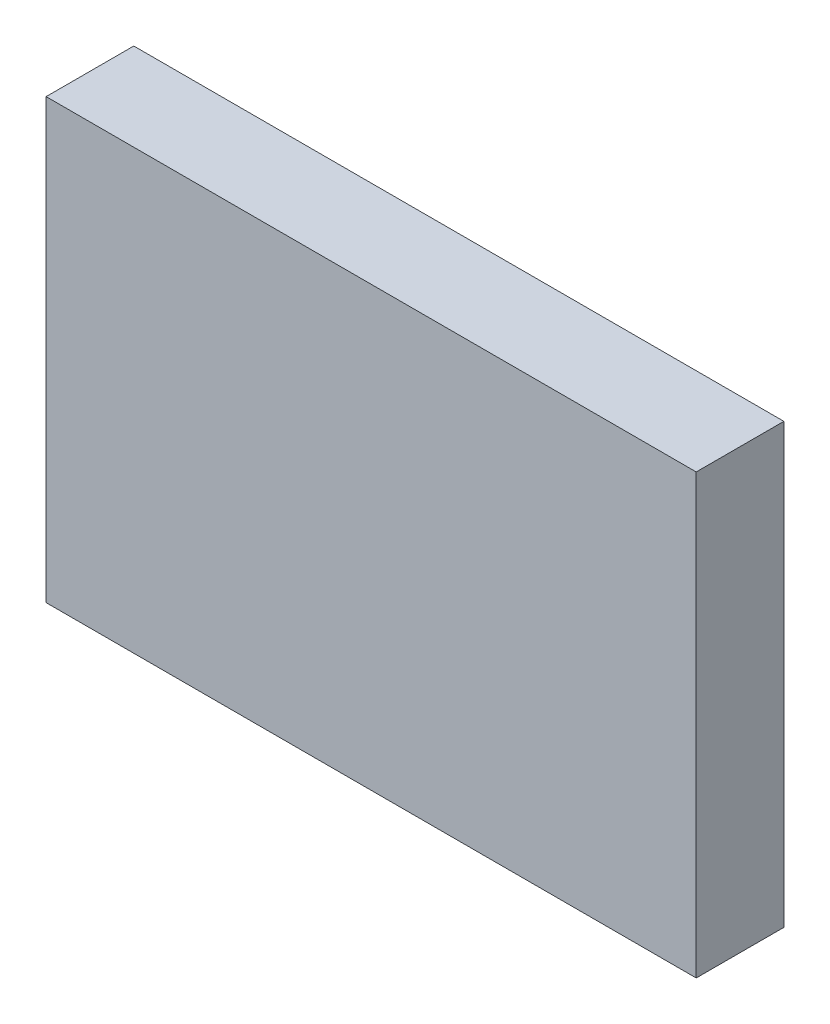
from build123d import *

# Parameters (mm, degrees)
SKETCH1_W           = 445
SKETCH1_H           = 300
BOSS_EXTRUDE1_DEPTH = 30


with BuildPart() as part:
    # Sketch1 → Boss-Extrude1 (new, symmetric)
    with BuildSketch(Plane.XY):
        Rectangle(SKETCH1_W, SKETCH1_H)
    extrude(amount=BOSS_EXTRUDE1_DEPTH, both=True)


solid = part.part
